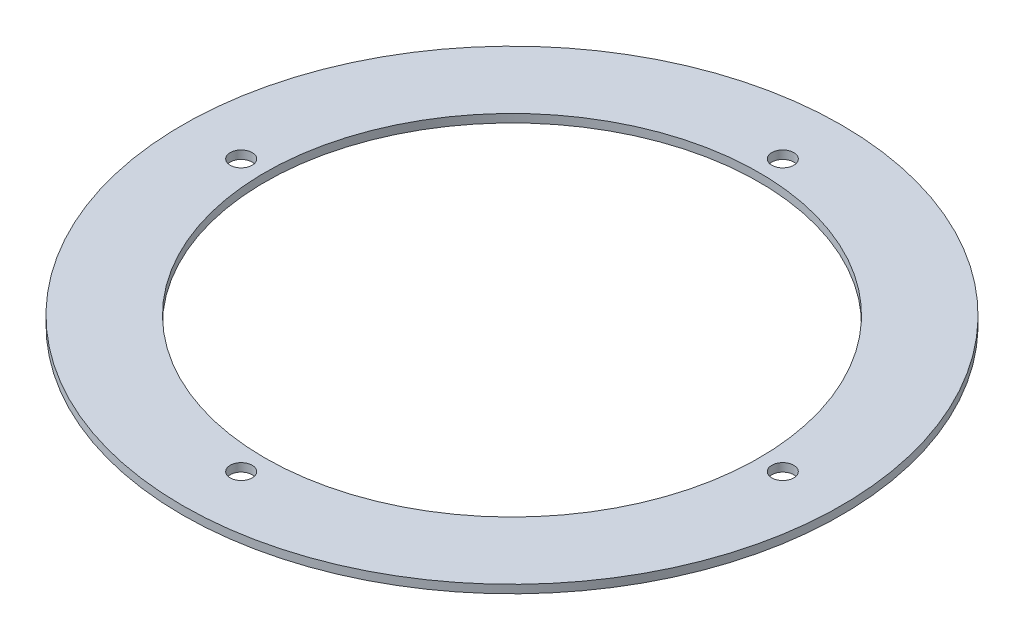
from build123d import *

# Parameters (mm, degrees)
SKETCH1_R           = 60
SKETCH1_R_2         = 45
SKETCH1_R_3         = 2
BOSS_EXTRUDE1_DEPTH = 1.5


with BuildPart() as part:
    # Sketch1 → Boss-Extrude1 (new body)
    with BuildSketch(Plane(origin=(0, 0, 0), x_dir=(1, 0, 0), z_dir=(0, 1, 0))):
        with Locations(Location((0, 0, 0), (0, 0, 270))):
            Circle(SKETCH1_R)
        with Locations(Location((0, 0, 0), (0, 0, 270))):
            Circle(SKETCH1_R_2, mode=Mode.SUBTRACT)
        with Locations(Location((0, 49.3, 0), (0, 0, 270))):
            Circle(SKETCH1_R_3, mode=Mode.SUBTRACT)
        with Locations(Location((49.3, 0, 0), (0, 0, 270))):
            Circle(SKETCH1_R_3, mode=Mode.SUBTRACT)
        with Locations(Location((0, -49.3, 0), (0, 0, 270))):
            Circle(SKETCH1_R_3, mode=Mode.SUBTRACT)
        with Locations(Location((-49.3, 0, 0), (0, 0, 270))):
            Circle(SKETCH1_R_3, mode=Mode.SUBTRACT)
    extrude(amount=BOSS_EXTRUDE1_DEPTH)


solid = part.part
